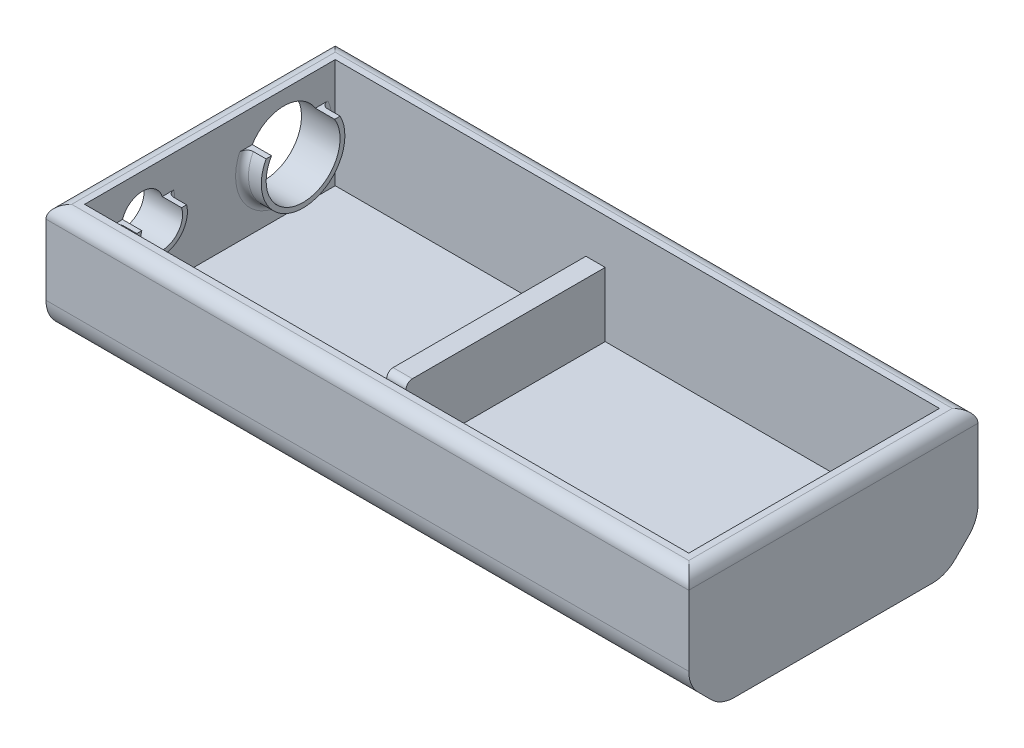
from build123d import *

# Parameters (mm, degrees)
SKETCH1_W           = 100
SKETCH1_H           = 45
BOSS_EXTRUDE1_DEPTH = 20
SHELL1_T            = -3
CHAMFER1_SIZE       = 5
FILLET1_R           = 5
SKETCH2_R           = 5.75
SKETCH2_R_2         = 3.25
CUT_EXTRUDE1_DEPTH  = 20
SKETCH3_R           = 1.5
CUT_EXTRUDE2_DEPTH  = 10
BOSS_EXTRUDE2_DEPTH = 3
FILLET2_R           = 1
SKETCH5_W           = 3
SKETCH5_H           = 39
BOSS_EXTRUDE3_DEPTH = 10
SKETCH6_W           = 3
SKETCH6_H           = 3
CUT_EXTRUDE3_DEPTH  = 5
FILLET3_R           = 1
FILLET4_R           = 2
FILLET6_R           = 0.5


with BuildPart() as part:
    # Sketch1 → Boss-Extrude1 (new body)
    with BuildSketch(Plane(origin=(0, 0, 0), x_dir=(1, 0, 0), z_dir=(0, 1, 0))):
        Rectangle(SKETCH1_W, SKETCH1_H)
    extrude(amount=BOSS_EXTRUDE1_DEPTH)

    # Shell1
    shell1_openings = [part.faces().sort_by_distance(p)[0] for p in [
        (0, 20, 0),
    ]]
    offset(amount=SHELL1_T, openings=shell1_openings, kind=Kind.INTERSECTION)

    # Chamfer1
    chamfer1_edges = [part.edges().sort_by_distance(p)[0] for p in [
        (0, 0, 22.5),
        (0, 0, -22.5),
    ]]
    chamfer(chamfer1_edges, length=CHAMFER1_SIZE)

    # Fillet1
    fillet1_edges = [part.edges().sort_by_distance(p)[0] for p in [
        (0, 5, -22.5),
        (0, 0, 17.5),
        (0, 0, -17.5),
        (0, 5, 22.5),
    ]]
    fillet(fillet1_edges, radius=FILLET1_R)

    # Sketch2 → Cut-Extrude1 (cut)
    with BuildSketch(Plane.ZY.offset(50)):
        with Locations((-11.5, 12)):
            Circle(SKETCH2_R)
        with Locations((10.5, 14)):
            Circle(SKETCH2_R_2)
    extrude(amount=-CUT_EXTRUDE1_DEPTH, mode=Mode.SUBTRACT)

    # Sketch3 → Cut-Extrude2 (cut)
    with BuildSketch(Plane.ZY.offset(50)):
        with Locations((13, 5)):
            Circle(SKETCH3_R)
    extrude(amount=-CUT_EXTRUDE2_DEPTH, mode=Mode.SUBTRACT)

    # Sketch4 → Boss-Extrude2 (add)
    with BuildSketch(Plane(origin=(-47, 0, 0), x_dir=(0, 0, -1), z_dir=(1, 0, 0))):
        with BuildLine():
            Line((5.733718703, 15), (6.594645782, 15))
            ThreePointArc((6.594645782, 15), (11.5, 6.25), (16.405354218, 15))
            Line((16.405354218, 15), (17.266281297, 15))
            ThreePointArc((17.266281297, 15), (11.5, 5.5), (5.733718703, 15))
        make_face()
        with BuildLine():
            Line((-14.372983346, 15), (-13.592329219, 15))
            ThreePointArc((-13.592329219, 15), (-10.5, 10.75), (-7.407670781, 15))
            Line((-7.407670781, 15), (-6.627016654, 15))
            ThreePointArc((-6.627016654, 15), (-10.5, 10), (-14.372983346, 15))
        make_face()
    extrude(amount=BOSS_EXTRUDE2_DEPTH)

    # Fillet2
    fillet2_edges = [part.edges().sort_by_distance(p)[0] for p in [
        (-47, 5.5, -11.5),
        (-47, 10, 10.5),
    ]]
    fillet(fillet2_edges, radius=FILLET2_R)

    # Sketch5 → Boss-Extrude3 (add)
    with BuildSketch(Plane(origin=(0, 3, 0), x_dir=(1, 0, 0), z_dir=(0, 1, 0))):
        with Locations((-6.5, 0)):
            Rectangle(SKETCH5_W, SKETCH5_H)
    extrude(amount=BOSS_EXTRUDE3_DEPTH)

    # Sketch6 → Cut-Extrude3 (cut)
    with BuildSketch(Plane(origin=(0, 13, 0), x_dir=(1, 0, 0), z_dir=(0, 1, 0))):
        with Locations((-6.5, -13)):
            Rectangle(SKETCH6_W, SKETCH6_H)
    extrude(amount=-CUT_EXTRUDE3_DEPTH, mode=Mode.SUBTRACT)

    # Fillet3
    fillet3_edges = [part.edges().sort_by_distance(p)[0] for p in [
        (-6.5, 13, 14.5),
        (-6.5, 13, 11.5),
    ]]
    fillet(fillet3_edges, radius=FILLET3_R)

    # Fillet4
    fillet4_edges = [part.edges().sort_by_distance(p)[0] for p in [
        (-50, 20, 0),
        (0, 20, 22.5),
        (50, 20, 0),
        (0, 20, -22.5),
    ]]
    fillet(fillet4_edges, radius=FILLET4_R)

    # Fillet6
    fillet6_edges = [part.edges().sort_by_distance(p)[0] for p in [
        (-50, 5, 11.5),
    ]]
    fillet(fillet6_edges, radius=FILLET6_R)


solid = part.part
